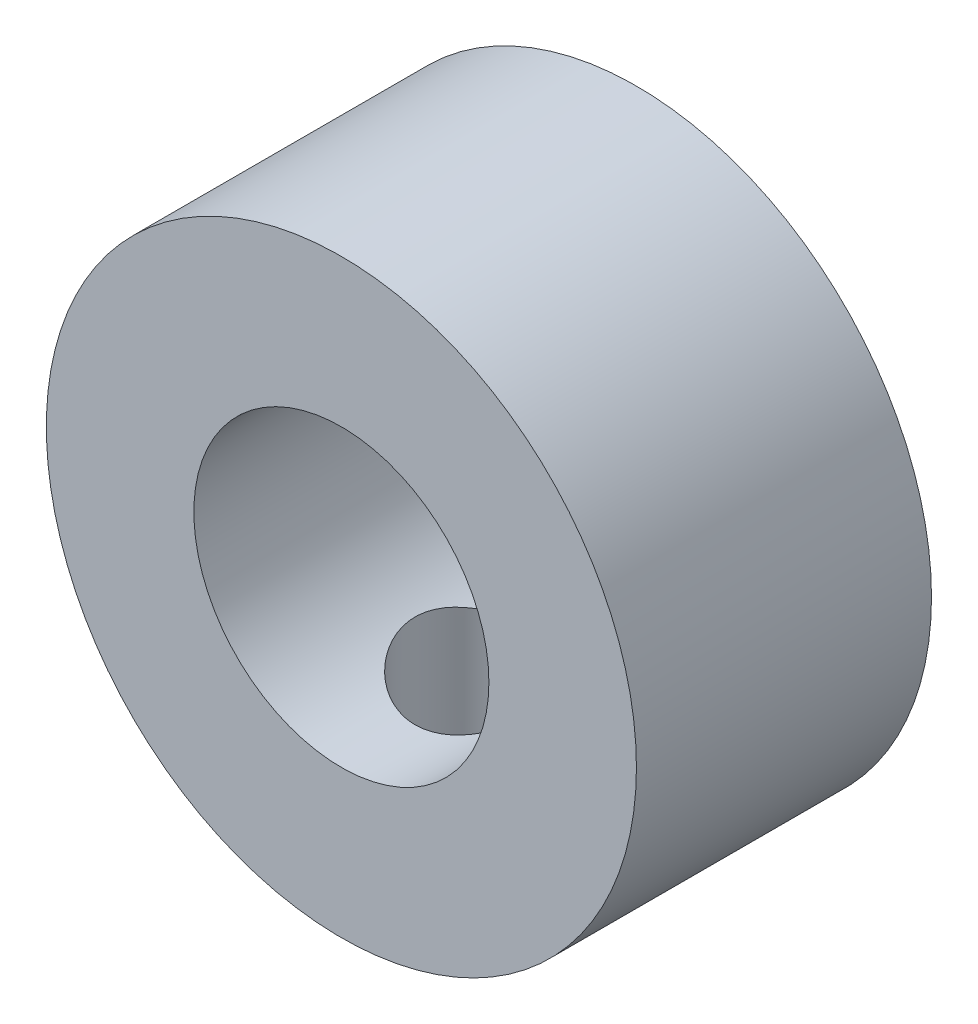
from build123d import *

# Parameters (mm, degrees)
ESQUISSE1_R             = 8
ESQUISSE1_R_2           = 4
BOSS_EXTRU_1_DEPTH      = 8
ESQUISSE2_R             = 2
ENL_V_MAT_EXTRU_1_DEPTH = 14.856406461


with BuildPart() as part:
    # Esquisse1 → Boss.-Extru.1 (new body)
    with BuildSketch(Plane.XY):
        Circle(ESQUISSE1_R)
        Circle(ESQUISSE1_R_2, mode=Mode.SUBTRACT)
    extrude(amount=BOSS_EXTRU_1_DEPTH)

    # Esquisse2 → Enlèv. mat.-Extru.1 (cut, through all)
    with BuildSketch(Plane(origin=(0, 0, 0), x_dir=(1, 0, 0), z_dir=(0, 1, 0))):
        with Locations(Location((0, -4, 0), (0, 0, 270))):
            Circle(ESQUISSE2_R)
    extrude(amount=-ENL_V_MAT_EXTRU_1_DEPTH, mode=Mode.SUBTRACT)


solid = part.part
